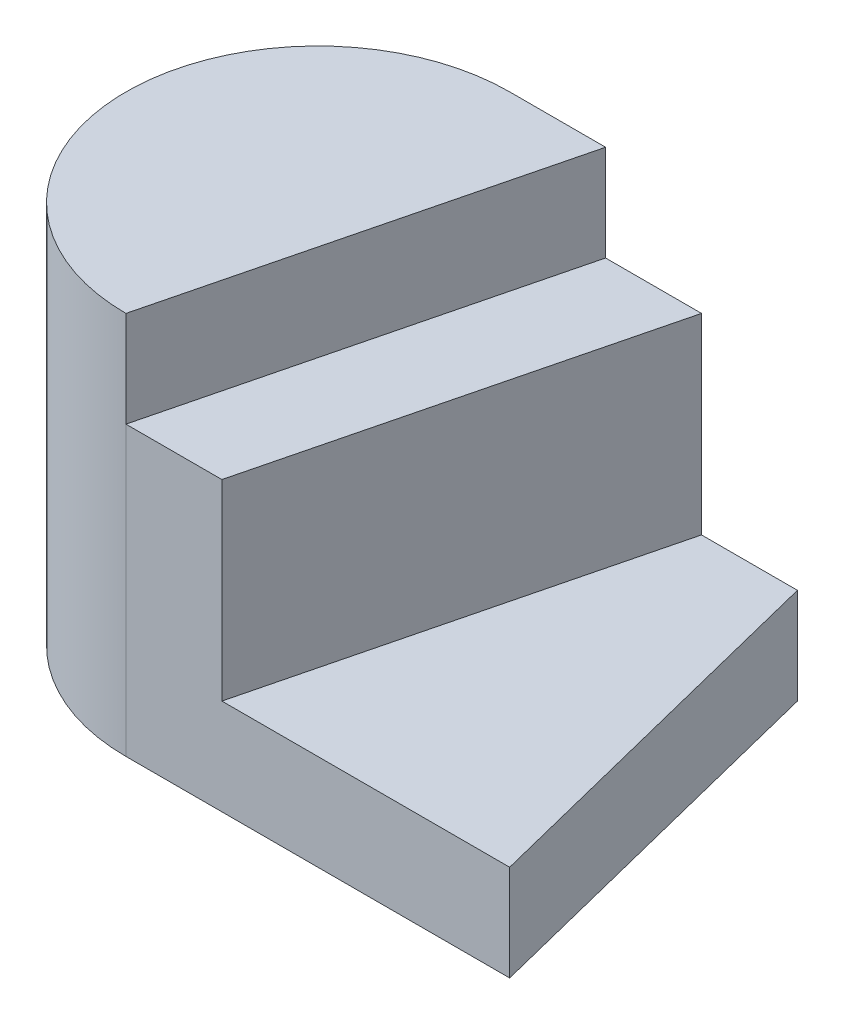
from build123d import *

# Parameters (mm, degrees)
EXTRUDE_1_DEPTH          = 20
CUT_EXTRUDE_1_DEPTH      = 5
CUT_EXTRUDE_2_DEPTH      = 27.925824036
CUT_EXTRUDE_2_DEPTH_BACK = 10


with BuildPart() as part:
    # 草圖1 → 填料-伸長1 (new body)
    with BuildSketch(Plane(origin=(0, 0, 0), x_dir=(1, 0, 0), z_dir=(0, 1, 0))):
        with BuildLine():
            Line((0, 10), (15, 10))
            Line((15, 10), (20, -10))
            Line((20, -10), (0, -10))
            ThreePointArc((0, -10), (-10, 0), (0, 10))
        make_face()
    extrude(amount=EXTRUDE_1_DEPTH)

    # 草圖2 → 除料-伸長1 (cut)
    with BuildSketch(Plane(origin=(0, 20, 0), x_dir=(1, 0, 0), z_dir=(0, 1, 0))):
        Polygon((5, 10), (0, -10), (5, -10), (10, 10), align=None)
    extrude(amount=-CUT_EXTRUDE_1_DEPTH, mode=Mode.SUBTRACT)

    # 草圖3 → 除料-伸長2 (cut, two sides: drawn at the far end of the back side and taken through both)
    with BuildSketch(Plane(origin=(0, 15, 0), x_dir=(1, 0, 0), z_dir=(0, 1, 0)).offset(-CUT_EXTRUDE_2_DEPTH_BACK)):
        Polygon((10, 10), (5, -10), (20, -10), (15, 10), align=None)
    extrude(amount=CUT_EXTRUDE_2_DEPTH + CUT_EXTRUDE_2_DEPTH_BACK, mode=Mode.SUBTRACT)


solid = part.part
